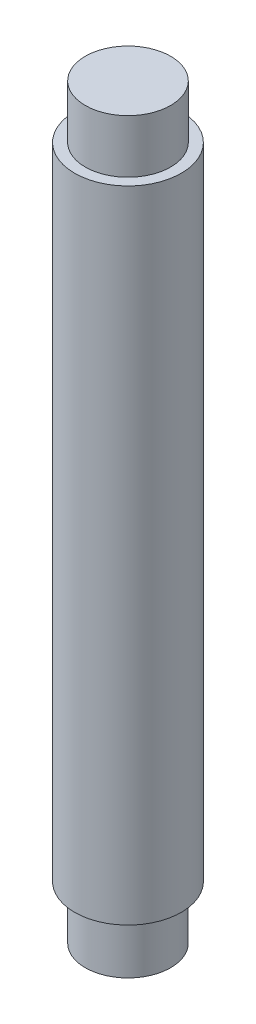
from build123d import *

# Parameters (mm, degrees)
ESQUISSE1_R        = 10
BOSS_EXTRU_1_DEPTH = 120
ESQUISSE2_R        = 8
BOSS_EXTRU_2_DEPTH = 10
BOSS_EXTRU_3_START = 10
ESQUISSE3_R        = 8
BOSS_EXTRU_3_DEPTH = 10


with BuildPart() as part:
    # Esquisse1 → Boss.-Extru.1 (new body)
    with BuildSketch(Plane(origin=(0, 0, 0), x_dir=(1, 0, 0), z_dir=(0, 1, 0))):
        with Locations(Location((0, 0, 0), (0, 0, 270))):
            Circle(ESQUISSE1_R)
    extrude(amount=BOSS_EXTRU_1_DEPTH)

    # Esquisse2 → Boss.-Extru.2 (add)
    with BuildSketch(Plane.XZ):
        with Locations(Location((0, 0, 0), (0, 0, 270))):
            Circle(ESQUISSE2_R)
    extrude(amount=BOSS_EXTRU_2_DEPTH)

    # Esquisse3 → Boss.-Extru.3 (add)
    with BuildSketch(Plane(origin=(0, 120, 0), x_dir=(1, 0, 0), z_dir=(0, 1, 0)).offset(BOSS_EXTRU_3_START)):
        with Locations(Location((0, 0, 0), (0, 0, 90))):
            Circle(ESQUISSE3_R)
    extrude(amount=-BOSS_EXTRU_3_DEPTH)


solid = part.part
